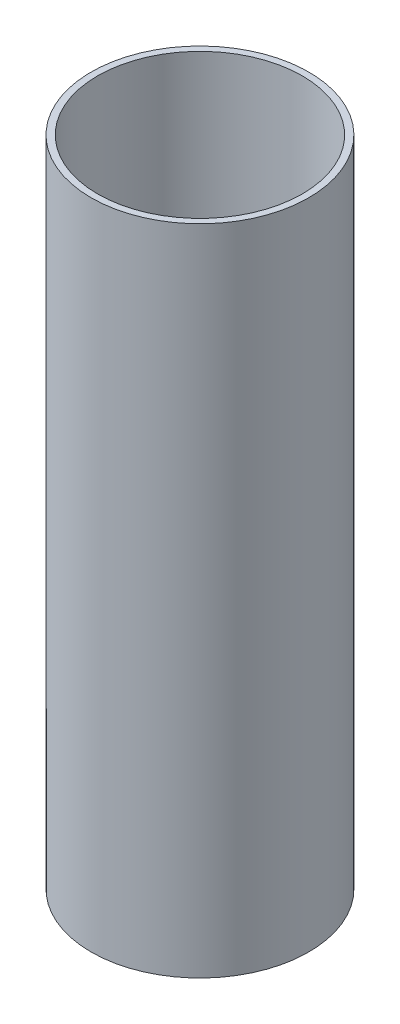
from build123d import *

# Parameters (mm, degrees)
SKETCH_1_R    = 25
SKETCH_1_R_2  = 23.5
F_50PVC_DEPTH = 150


with BuildPart() as part:
    # 草图1 → 50PVC (new body)
    with BuildSketch(Plane(origin=(0, 0, 0), x_dir=(1, 0, 0), z_dir=(0, 1, 0))):
        with Locations(Location((0, 0, 0), (0, 0, 270))):
            Circle(SKETCH_1_R)
        with Locations(Location((0, 0, 0), (0, 0, 270))):
            Circle(SKETCH_1_R_2, mode=Mode.SUBTRACT)
    extrude(amount=F_50PVC_DEPTH)


solid = part.part
